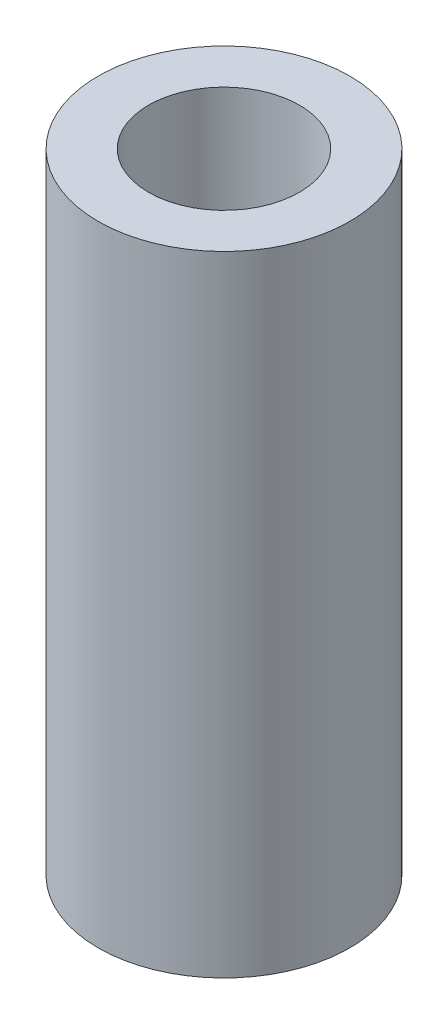
from build123d import *

# Parameters (mm, degrees)
SKETCH1_R           = 5
SKETCH1_R_2         = 3
BOSS_EXTRUDE1_DEPTH = 25


with BuildPart() as part:
    # Sketch1 → Boss-Extrude1 (new body)
    with BuildSketch(Plane(origin=(0, 0, 0), x_dir=(1, 0, 0), z_dir=(0, 1, 0))):
        with Locations(Location((0, 0, 0), (0, 0, 270))):
            Circle(SKETCH1_R)
        with Locations(Location((0, 0, 0), (0, 0, 270))):
            Circle(SKETCH1_R_2, mode=Mode.SUBTRACT)
    extrude(amount=BOSS_EXTRUDE1_DEPTH)


solid = part.part
